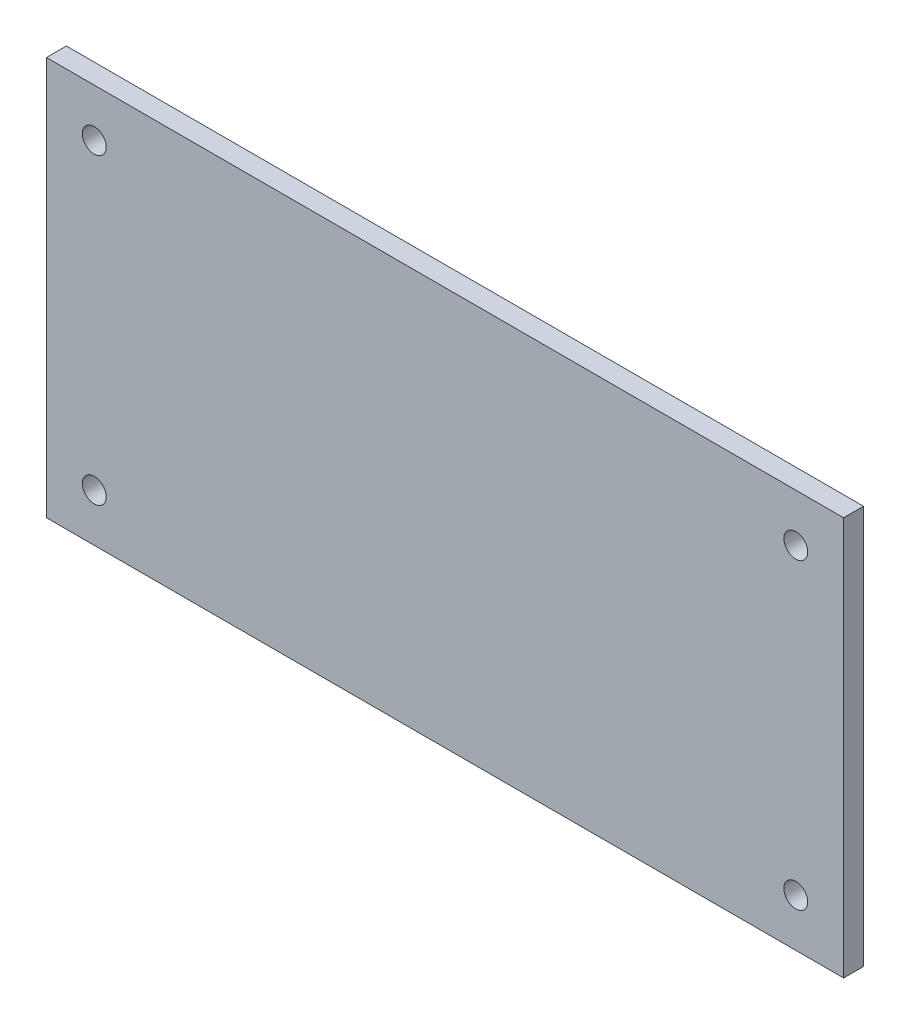
from build123d import *

# Parameters (mm, degrees)
SKETCH_1_W          = 2000
SKETCH_1_H          = 1000
EXTRUDE_1_DEPTH     = 50
SKETCH_2_R          = 30
CUT_EXTRUDE_1_DEPTH = 1120.15146428
SKETCH_3_R          = 30
CUT_EXTRUDE_2_DEPTH = 1120.15146428
SKETCH_4_R          = 30
CUT_EXTRUDE_3_DEPTH = 1120.15146428
SKETCH_5_R          = 30
CUT_EXTRUDE_4_DEPTH = 1120.15146428


with BuildPart() as part:
    # 草图1 → 凸台-拉伸1 (new body)
    with BuildSketch(Plane.XY):
        Rectangle(SKETCH_1_W, SKETCH_1_H)
    extrude(amount=EXTRUDE_1_DEPTH)

    # 草图2 → 切除-拉伸1 (cut, through all)
    with BuildSketch(Plane.XY):
        with Locations((880, 380)):
            Circle(SKETCH_2_R)
    extrude(amount=CUT_EXTRUDE_1_DEPTH, mode=Mode.SUBTRACT)

    # 草图3 → 切除-拉伸2 (cut, through all)
    with BuildSketch(Plane.XY):
        with Locations((880, -380)):
            Circle(SKETCH_3_R)
    extrude(amount=CUT_EXTRUDE_2_DEPTH, mode=Mode.SUBTRACT)

    # 草图4 → 切除-拉伸3 (cut, through all)
    with BuildSketch(Plane.XY):
        with Locations((-880, 380)):
            Circle(SKETCH_4_R)
    extrude(amount=CUT_EXTRUDE_3_DEPTH, mode=Mode.SUBTRACT)

    # 草图5 → 切除-拉伸4 (cut, through all)
    with BuildSketch(Plane.XY):
        with Locations((-880, -380)):
            Circle(SKETCH_5_R)
    extrude(amount=CUT_EXTRUDE_4_DEPTH, mode=Mode.SUBTRACT)


solid = part.part
